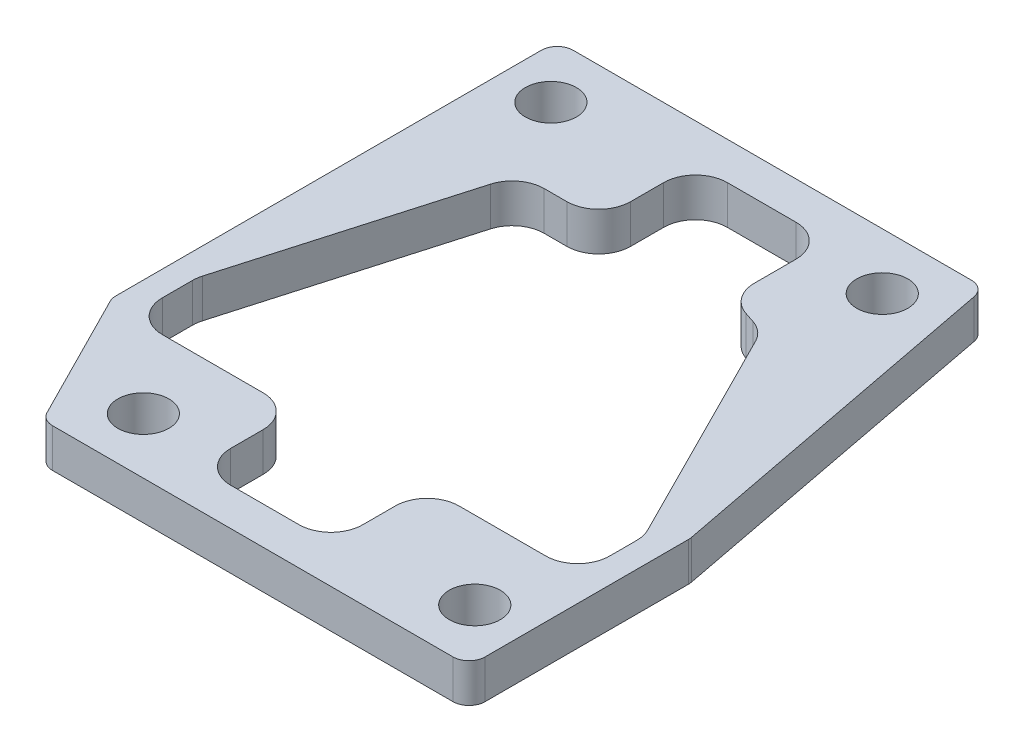
from build123d import *

# Parameters (mm, degrees)
SKETCH1_R           = 2.032
BOSS_EXTRUDE1_DEPTH = 3.0861


with BuildPart() as part:
    # Sketch1 → Boss-Extrude1 (new body)
    with BuildSketch(Plane(origin=(0, 0, 0), x_dir=(1, 0, 0), z_dir=(0, 1, 0))):
        with BuildLine():
            Line((-2.6924, 4.4704), (28.98404818, 4.4704))
            ThreePointArc((28.98404818, 4.4704), (29.793051754, 4.179385811), (30.23129703, 3.439712155))
            Line((30.23129703, 3.439712155), (35.572400198, -24.397088649))
            ThreePointArc((35.572400198, -24.397088649), (35.589450767, -24.516205211), (35.595151349, -24.636400804))
            Line((35.595151349, -24.636400804), (35.595151349, -40.835711832))
            ThreePointArc((35.595151349, -40.835711832), (35.223176961, -41.733737444), (34.325151349, -42.105711832))
            Line((34.325151349, -42.105711832), (2.465757874, -42.105711832))
            ThreePointArc((2.465757874, -42.105711832), (1.800944431, -41.917803827), (1.332861331, -41.409685196))
            Line((1.332861331, -41.409685196), (-3.825296543, -31.228621763))
            ThreePointArc((-3.825296543, -31.228621763), (-3.927648681, -30.949708893), (-3.9624, -30.6546484))
            Line((-3.9624, -30.6546484), (-3.9624, 3.2004))
            ThreePointArc((-3.9624, 3.2004), (-3.590425612, 4.098425612), (-2.6924, 4.4704))
        make_face()
        with Locations(Location((0, 0, 0), (0, 0, 270))):
            Circle(SKETCH1_R, mode=Mode.SUBTRACT)
        with Locations(Location((26.3652, 0, 0), (0, 0, 270))):
            Circle(SKETCH1_R, mode=Mode.SUBTRACT)
        with Locations(Location((5.242151349, -37.660711832, 0), (0, 0, 270))):
            Circle(SKETCH1_R, mode=Mode.SUBTRACT)
        with Locations(Location((31.607351349, -37.660711832, 0), (0, 0, 270))):
            Circle(SKETCH1_R, mode=Mode.SUBTRACT)
        with BuildLine():
            Line((12.5603, 1.4859), (18.0213, 1.4859))
            ThreePointArc((18.0213, 1.4859), (19.817351224, 0.741951224), (20.5613, -1.0541))
            Line((20.5613, -1.0541), (20.5613, -4.374589338))
            ThreePointArc((20.5613, -4.374589338), (21.042661976, -5.86240972), (22.304299596, -6.786308716))
            Line((22.304299596, -6.786308716), (23.138687105, -7.062048584))
            ThreePointArc((23.138687105, -7.062048584), (24.000408807, -7.550166917), (24.609958316, -8.330726456))
            Line((24.609958316, -8.330726456), (33.329522963, -25.633983509))
            ThreePointArc((33.329522963, -25.633983509), (33.532385694, -26.189577102), (33.601251349, -26.777025014))
            Line((33.601251349, -26.777025014), (33.601251349, -28.923111832))
            ThreePointArc((33.601251349, -28.923111832), (32.857302573, -30.719163056), (31.061251349, -31.463111832))
            Line((31.061251349, -31.463111832), (24.165151349, -31.463111832))
            ThreePointArc((24.165151349, -31.463111832), (22.369100125, -32.207060608), (21.625151349, -34.003111832))
            Line((21.625151349, -34.003111832), (21.625151349, -36.581211832))
            ThreePointArc((21.625151349, -36.581211832), (20.881202573, -38.377263056), (19.085151349, -39.121211832))
            Line((19.085151349, -39.121211832), (13.649551349, -39.121211832))
            ThreePointArc((13.649551349, -39.121211832), (11.853500125, -38.377263056), (11.109551349, -36.581211832))
            Line((11.109551349, -36.581211832), (11.109551349, -34.003111832))
            ThreePointArc((11.109551349, -34.003111832), (10.365602573, -32.207060608), (8.569551349, -31.463111832))
            Line((8.569551349, -31.463111832), (0.5588, -31.463111832))
            ThreePointArc((0.5588, -31.463111832), (-1.237251224, -30.719163056), (-1.9812, -28.923111832))
            Line((-1.9812, -28.923111832), (-1.9812, -26.531672272))
            ThreePointArc((-1.9812, -26.531672272), (-1.956276805, -26.176723455), (-1.881996329, -25.828740353))
            Line((-1.881996329, -25.828740353), (3.23891195, -8.047368081))
            ThreePointArc((3.23891195, -8.047368081), (4.15226713, -6.72088542), (5.679708279, -6.2103))
            Line((5.679708279, -6.2103), (7.4803, -6.2103))
            ThreePointArc((7.4803, -6.2103), (9.276351224, -5.466351224), (10.0203, -3.6703))
            Line((10.0203, -3.6703), (10.0203, -1.0541))
            ThreePointArc((10.0203, -1.0541), (10.764248776, 0.741951224), (12.5603, 1.4859))
        make_face(mode=Mode.SUBTRACT)
    extrude(amount=BOSS_EXTRUDE1_DEPTH)


solid = part.part
